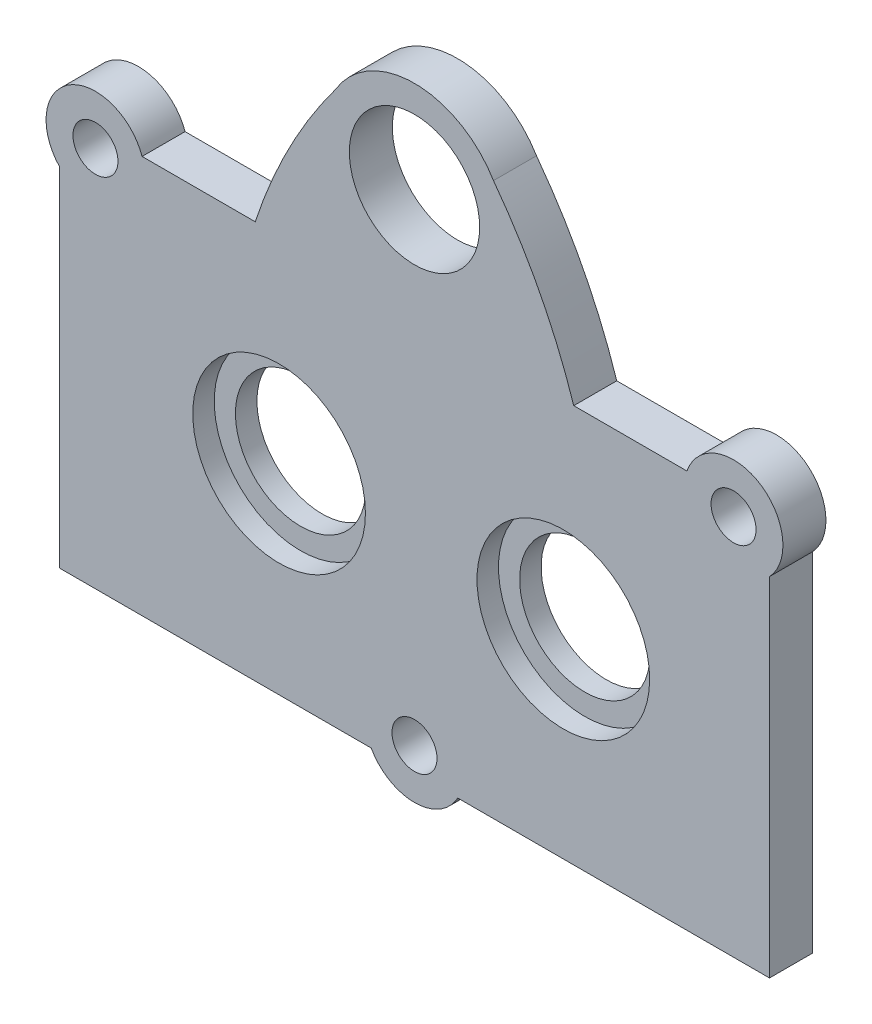
from build123d import *

# Parameters (mm, degrees)
SKETCH1_W            = 6.266
SKETCH1_H            = 19.6
SKETCH1_R            = 1.475
SKETCH1_W_2          = 52.832
SKETCH1_H_2          = 5
BOSS_EXTRUDE2_DEPTH  = 3.2
SKETCH3_R            = 6.85
SKETCH3_R_2          = 4.85
BOSS_EXTRUDE3_DEPTH  = 5.975
SKETCH5_R            = 6.85
CUT_EXTRUDE2_DEPTH   = 2.4892
SKETCH10_R           = 6.846
BOSS_EXTRUDE10_DEPTH = 3.4858
SKETCH11_W           = 13.7
SKETCH11_H           = 5
BOSS_EXTRUDE11_DEPTH = 5.975
SKETCH15_W           = 52.832
SKETCH15_H           = 29.6
BOSS_EXTRUDE13_DEPTH = 3.2
SKETCH18_R           = 4.85
CUT_EXTRUDE9_DEPTH   = 32.638989886
SKETCH17_W           = 26.060927771
SKETCH17_H           = 40.585710908
CUT_EXTRUDE10_DEPTH  = 5.975
SKETCH12_W           = 52.832
SKETCH12_H           = 29.6
BOSS_EXTRUDE12_DEPTH = 3.2
SKETCH13_R           = 4.85
CUT_EXTRUDE3_DEPTH   = 10
SKETCH19_R           = 1.675
CUT_EXTRUDE11_DEPTH  = 3.2
SKETCH20_R           = 3.675
SKETCH20_R_2         = 1.675
BOSS_EXTRUDE14_DEPTH = 3.2
BOSS_EXTRUDE15_START = -3.2
SKETCH21_R           = 3.675
SKETCH21_R_2         = 1.675
BOSS_EXTRUDE15_DEPTH = 3.2
SKETCH27_R           = 4.85
CUT_EXTRUDE18_DEPTH  = 188
SKETCH30_R           = 6.85
SKETCH30_R_2         = 4.85
BOSS_EXTRUDE17_DEPTH = 3.2
BOSS_EXTRUDE18_DEPTH = 3.2
SKETCH32_R           = 6.425
CUT_EXTRUDE19_DEPTH  = 1.6


with BuildPart() as part:
    # Sketch1 → Boss-Extrude2 (new body)
    # profile 1 of 4: a face of its own
    with BuildSketch(Plane.XY):
        with Locations((-23.283, 0)):
            Rectangle(SKETCH1_W, SKETCH1_H)
        with Locations((-23.95, -4.974)):
            Circle(SKETCH1_R, mode=Mode.SUBTRACT)
        with Locations((-23.95, 4.974)):
            Circle(SKETCH1_R, mode=Mode.SUBTRACT)
    # profile 2 of 4: a face of its own
    with BuildSketch(Plane.XY):
        with Locations((23.283, 0)):
            Rectangle(SKETCH1_W, SKETCH1_H)
        with Locations((23.95, -4.974)):
            Circle(SKETCH1_R, mode=Mode.SUBTRACT)
        with Locations((23.95, 4.974)):
            Circle(SKETCH1_R, mode=Mode.SUBTRACT)
    # profile 3 of 4: a face of its own
    with BuildSketch(Plane.XY):
        with Locations((0, 12.3)):
            Rectangle(SKETCH1_W_2, SKETCH1_H_2)
    # profile 4 of 4: a face of its own
    with BuildSketch(Plane.XY):
        with Locations((0, -12.3)):
            Rectangle(SKETCH1_W_2, SKETCH1_H_2)
    extrude(amount=BOSS_EXTRUDE2_DEPTH)



with BuildPart() as body_2:
    # Sketch3 → Boss-Extrude3 (new body)
    with BuildSketch(Plane(origin=(0, 0, 0), x_dir=(-1, 0, 0), z_dir=(0, 0, -1))):
        with Locations(Location((10.076, 0.11, 0), (0, 0, 180))):
            Circle(SKETCH3_R)
        with Locations(Location((10.076, 0.11, 0), (0, 0, 180))):
            Circle(SKETCH3_R_2, mode=Mode.SUBTRACT)
    extrude(amount=BOSS_EXTRUDE3_DEPTH)

    # Sketch5 → Cut-Extrude2 (cut)
    with BuildSketch(Plane.XY):
        with Locations((-10.076, 0.11)):
            Circle(SKETCH5_R)
    extrude(amount=-CUT_EXTRUDE2_DEPTH, mode=Mode.SUBTRACT)

    # Sketch10 → Boss-Extrude10 (add)
    with BuildSketch(Plane(origin=(0, 0, -5.975), x_dir=(-1, 0, 0), z_dir=(0, 0, -1))):
        Polygon((16.93, -14.8), (16.93, 14.8), (3.23, 14.8), (3.23, 0.11), (3.23, -14.8), align=None)
        with Locations((10.076, 0.11)):
            Circle(SKETCH10_R, mode=Mode.SUBTRACT)
    extrude(amount=-BOSS_EXTRUDE10_DEPTH)


with BuildPart() as boss_extrude10_kept_piece:
    # of the separate pieces the step leaves, the one the design keeps (boss_extrude10_pieces_kept)
    add(body_2.part.solids().sort_by_distance((-3.23, -0.124059821, -5.975))[0])


with BuildPart() as part_1:
    add(part.part)

    add(boss_extrude10_kept_piece.part)  # Boss-Extrude11 merges Boss-Extrude10 kept piece
    # Sketch11 → Boss-Extrude11 (add)
    with BuildSketch(Plane(origin=(0, 0, -5.975), x_dir=(-1, 0, 0), z_dir=(0, 0, -1))):
        with Locations((10.08, 12.3)):
            Rectangle(SKETCH11_W, SKETCH11_H)
        with Locations((10.08, -12.3)):
            Rectangle(SKETCH11_W, SKETCH11_H)
    extrude(amount=-BOSS_EXTRUDE11_DEPTH)

    # Sketch15 → Boss-Extrude13 (add)
    with BuildSketch(Plane(origin=(0, 0, 0), x_dir=(-1, 0, 0), z_dir=(0, 0, -1))):
        Rectangle(SKETCH15_W, SKETCH15_H)
    extrude(amount=-BOSS_EXTRUDE13_DEPTH)

    # Sketch18 → Cut-Extrude9 (cut, through all)
    with BuildSketch(Plane(origin=(0, 0, -5.975), x_dir=(-1, 0, 0), z_dir=(0, 0, -1))):
        with Locations(Location((10.076, 0.11, 0), (0, 0, 180))):
            Circle(SKETCH18_R)
    extrude(amount=-CUT_EXTRUDE9_DEPTH, mode=Mode.SUBTRACT)

    # Sketch17 → Cut-Extrude10 (cut)
    with BuildSketch(Plane(origin=(0, 0, -5.975), x_dir=(-1, 0, 0), z_dir=(0, 0, -1))):
        with Locations((8.607278897, -0.029886385)):
            Rectangle(SKETCH17_W, SKETCH17_H)
    extrude(amount=-CUT_EXTRUDE10_DEPTH, mode=Mode.SUBTRACT)

    # Sketch12 → Boss-Extrude12 (add)
    with BuildSketch(Plane.XY.offset(3.2)):
        Rectangle(SKETCH12_W, SKETCH12_H)
    extrude(amount=-BOSS_EXTRUDE12_DEPTH)

    # Sketch13 → Cut-Extrude3 (cut)
    with BuildSketch(Plane(origin=(0, 0, 0), x_dir=(-1, 0, 0), z_dir=(0, 0, -1))):
        with Locations((10.076, 0.11)):
            Circle(SKETCH13_R)
    extrude(amount=-CUT_EXTRUDE3_DEPTH, mode=Mode.SUBTRACT)

    # Sketch19 → Cut-Extrude11 (cut)
    with BuildSketch(Plane.XY.offset(3.2)):
        with Locations((0, -13.025)):
            Circle(SKETCH19_R)
        with Locations((-23.741, 13.587)):
            Circle(SKETCH19_R)
        with Locations((23.741, 13.587)):
            Circle(SKETCH19_R)
    extrude(amount=-CUT_EXTRUDE11_DEPTH, mode=Mode.SUBTRACT)

    # Sketch20 → Boss-Extrude14 (add)
    with BuildSketch(Plane.XY.offset(3.2)):
        with Locations((0, -13.025)):
            Circle(SKETCH20_R)
        with Locations((0, -13.025)):
            Circle(SKETCH20_R_2, mode=Mode.SUBTRACT)
    extrude(amount=-BOSS_EXTRUDE14_DEPTH)

    # Sketch21 → Boss-Extrude15 (add)
    # profile 1 of 2: a face of its own
    with BuildSketch(Plane(origin=(0, 0, 0), x_dir=(-1, 0, 0), z_dir=(0, 0, -1)).offset(BOSS_EXTRUDE15_START)):
        with Locations((23.741, 13.587)):
            Circle(SKETCH21_R)
        with Locations(Location((23.741, 13.587, 0), (0, 0, 180))):
            Circle(SKETCH21_R_2, mode=Mode.SUBTRACT)
    # profile 2 of 2: a face of its own
    with BuildSketch(Plane(origin=(0, 0, 0), x_dir=(-1, 0, 0), z_dir=(0, 0, -1)).offset(BOSS_EXTRUDE15_START)):
        with Locations((-23.741, 13.587)):
            Circle(SKETCH21_R)
        with Locations(Location((-23.741, 13.587, 0), (0, 0, 180))):
            Circle(SKETCH21_R_2, mode=Mode.SUBTRACT)
    extrude(amount=BOSS_EXTRUDE15_DEPTH)

    # Sketch27 → Cut-Extrude18 (cut)
    with BuildSketch(Plane.XY.offset(3.2)):
        with Locations((11.074, 0)):
            Circle(SKETCH27_R)
    extrude(amount=-CUT_EXTRUDE18_DEPTH, mode=Mode.SUBTRACT)

    # Sketch30 → Boss-Extrude17 (add)
    # profile 1 of 2: a face of its own
    with BuildSketch(Plane.XY.offset(3.2)):
        with Locations((0, 22.8)):
            Circle(SKETCH30_R)
        with Locations((0, 22.8)):
            Circle(SKETCH30_R_2, mode=Mode.SUBTRACT)
    # profile 2 of 2: a face of its own
    with BuildSketch(Plane.XY.offset(3.2)):
        with BuildLine():
            ThreePointArc((6.85, 22.8), (0, 15.95), (-6.85, 22.8))
            Line((-6.85, 22.8), (-6.85, 14.8))
            Line((-6.85, 14.8), (6.85, 14.8))
            Line((6.85, 14.8), (6.85, 22.8))
        make_face()
    extrude(amount=-BOSS_EXTRUDE17_DEPTH)

    # Sketch31 → Boss-Extrude18 (add)
    with BuildSketch(Plane.XY.offset(3.2)):
        with BuildLine():
            Line((-6.85, 14.8), (-6.85, 22.8))
            ThreePointArc((-6.85, 22.8), (-6.602617872, 24.624263479), (-5.878339492, 26.316763401))
            ThreePointArc((-5.878339492, 26.316763401), (-9.334173967, 20.802087814), (-11.85, 14.8))
            Line((-11.85, 14.8), (-6.85, 14.8))
        make_face()
        with BuildLine():
            ThreePointArc((5.878339492, 26.316763401), (6.602617872, 24.624263479), (6.85, 22.8))
            Line((6.85, 22.8), (6.85, 14.8))
            Line((6.85, 14.8), (11.85, 14.8))
            ThreePointArc((11.85, 14.8), (9.334173967, 20.802087814), (5.878339492, 26.316763401))
        make_face()
    extrude(amount=-BOSS_EXTRUDE18_DEPTH)

    # Sketch32 → Cut-Extrude19 (cut)
    with BuildSketch(Plane.XY.offset(3.2)):
        with Locations((-10.076, 0.11)):
            Circle(SKETCH32_R)
        with Locations((11.074, 0)):
            Circle(SKETCH32_R)
    extrude(amount=-CUT_EXTRUDE19_DEPTH, mode=Mode.SUBTRACT)


solid = part_1.part
